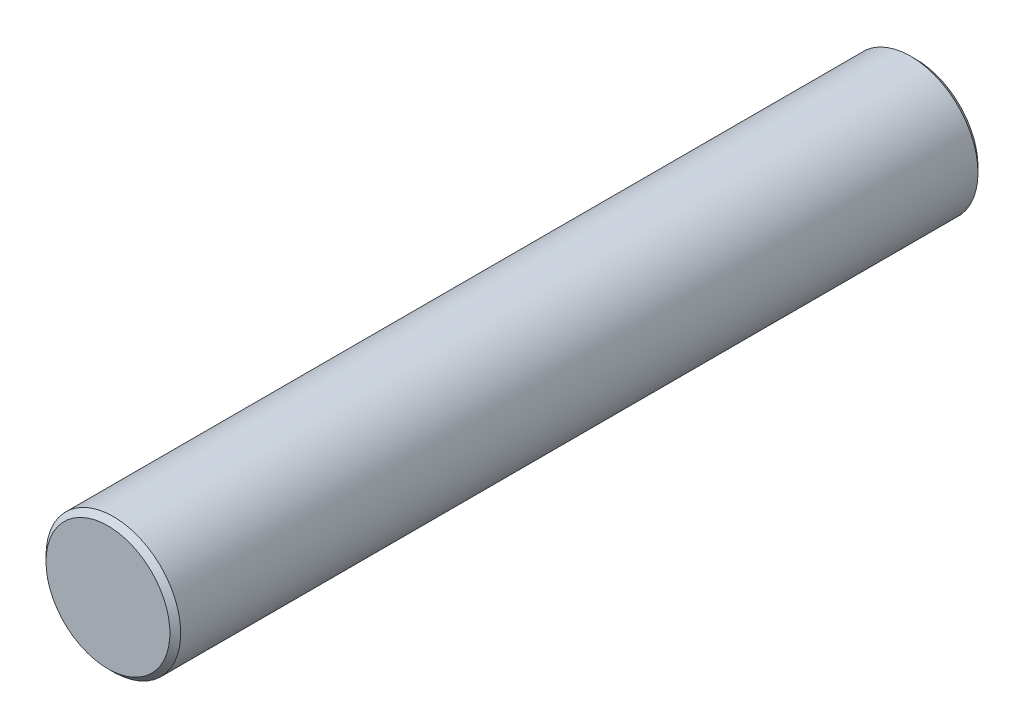
from build123d import *

# Parameters (mm, degrees)
SKETCH1_R           = 7.9375
BOSS_EXTRUDE1_DEPTH = 95.25
CHAMFER1_SIZE       = 0.635


with BuildPart() as part:
    # Sketch1 → Boss-Extrude1 (new body)
    with BuildSketch(Plane.XY):
        Circle(SKETCH1_R)
    extrude(amount=BOSS_EXTRUDE1_DEPTH)

    # Chamfer1
    chamfer1_edges = [part.edges().sort_by_distance(p)[0] for p in [
        (-7.9375, 0, 0),
        (-7.9375, 0, 95.25),
    ]]
    chamfer(chamfer1_edges, length=CHAMFER1_SIZE)


solid = part.part
